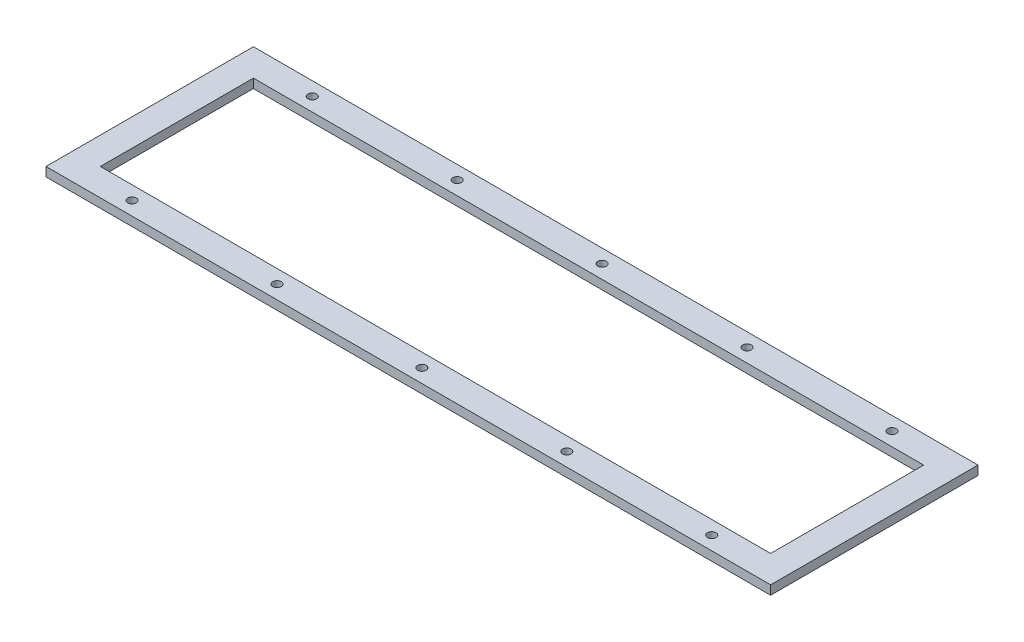
from build123d import *

# Parameters (mm, degrees)
SKETCH1_W           = 254
SKETCH1_H           = 72.69988
SKETCH1_R           = 1.5
SKETCH1_W_2         = 234.95
SKETCH1_H_2         = 53.64988
BOSS_EXTRUDE1_DEPTH = 3.175


with BuildPart() as part:
    # Sketch1 → Boss-Extrude1 (new body)
    with BuildSketch(Plane(origin=(0, 0, 0), x_dir=(1, 0, 0), z_dir=(0, 1, 0))):
        with Locations((127, 36.34994)):
            Rectangle(SKETCH1_W, SKETCH1_H)
        with Locations(Location((177.8, 67.93738, 0), (0, 0, 270))):
            Circle(SKETCH1_R, mode=Mode.SUBTRACT)
        with Locations(Location((177.8, 4.7625, 0), (0, 0, 90))):
            Circle(SKETCH1_R, mode=Mode.SUBTRACT)
        with Locations(Location((228.6, 67.93738, 0), (0, 0, 270))):
            Circle(SKETCH1_R, mode=Mode.SUBTRACT)
        with Locations(Location((228.6, 4.7625, 0), (0, 0, 90))):
            Circle(SKETCH1_R, mode=Mode.SUBTRACT)
        with Locations(Location((127, 67.93738, 0), (0, 0, 270))):
            Circle(SKETCH1_R, mode=Mode.SUBTRACT)
        with Locations(Location((127, 4.7625, 0), (0, 0, 90))):
            Circle(SKETCH1_R, mode=Mode.SUBTRACT)
        with Locations(Location((25.4, 4.7625, 0), (0, 0, 270))):
            Circle(SKETCH1_R, mode=Mode.SUBTRACT)
        with Locations(Location((76.2, 4.7625, 0), (0, 0, 270))):
            Circle(SKETCH1_R, mode=Mode.SUBTRACT)
        with Locations(Location((25.4, 67.93738, 0), (0, 0, 90))):
            Circle(SKETCH1_R, mode=Mode.SUBTRACT)
        with Locations(Location((76.2, 67.93738, 0), (0, 0, 90))):
            Circle(SKETCH1_R, mode=Mode.SUBTRACT)
        with Locations((127, 36.34994)):
            Rectangle(SKETCH1_W_2, SKETCH1_H_2, mode=Mode.SUBTRACT)
    extrude(amount=-BOSS_EXTRUDE1_DEPTH)


solid = part.part
